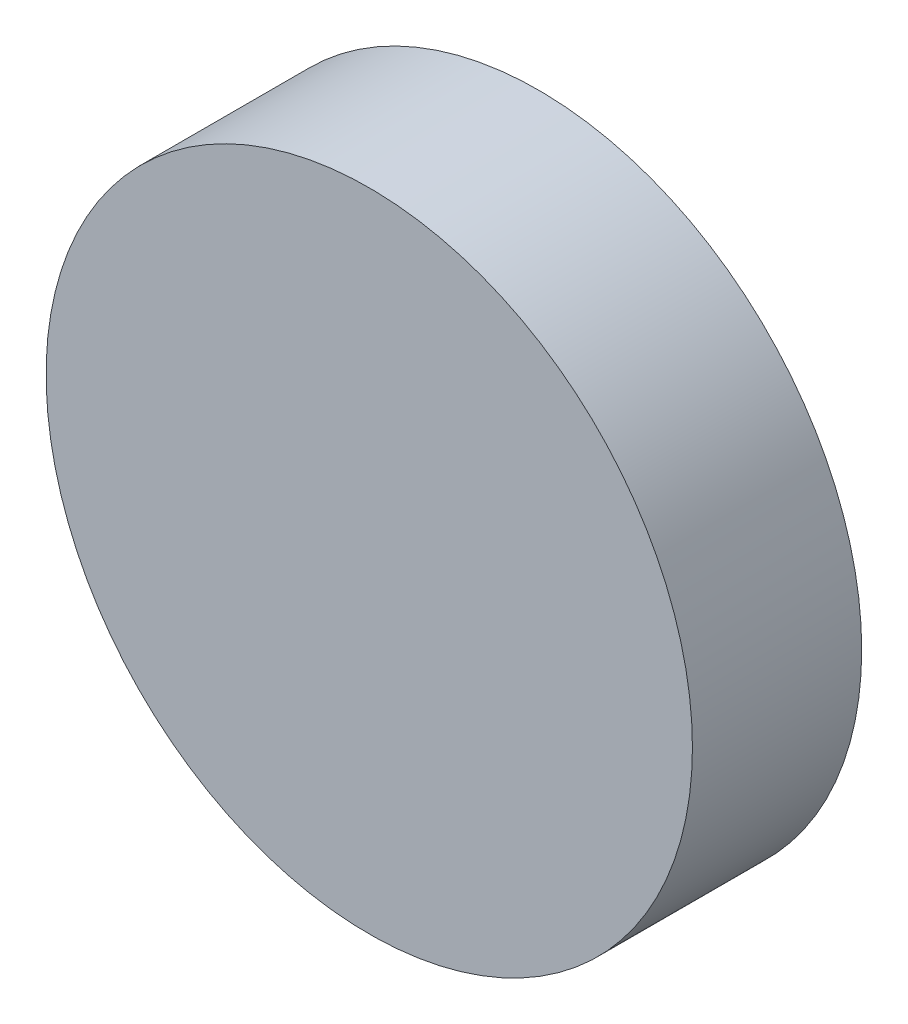
from build123d import *

# Parameters (mm, degrees)
SKETCH1_R           = 210
BOSS_EXTRUDE1_DEPTH = 110


with BuildPart() as part:
    # Sketch1 → Boss-Extrude1 (new body)
    with BuildSketch(Plane.XY):
        Circle(SKETCH1_R)
    extrude(amount=BOSS_EXTRUDE1_DEPTH)


solid = part.part
